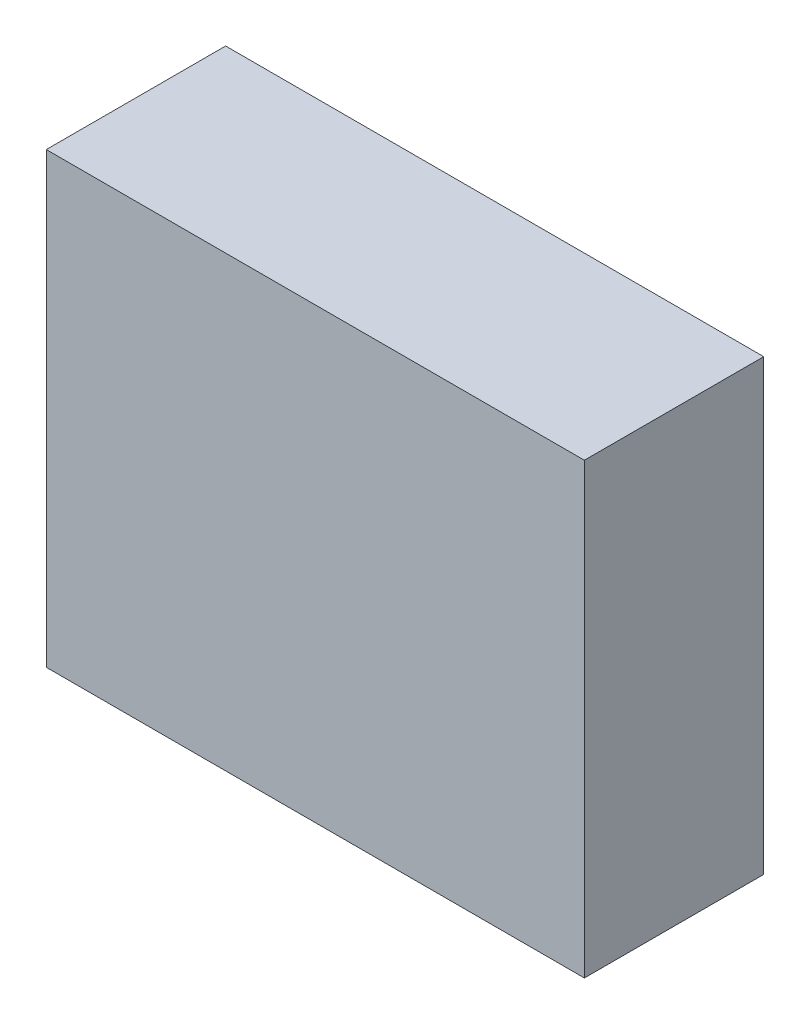
from build123d import *

# Parameters (mm, degrees)
SKETCH1_W           = 60
SKETCH1_H           = 50
BOSS_EXTRUDE1_DEPTH = 10
SKETCH2_W           = 15
SKETCH2_H           = 30
REVOLVE1_ANGLE      = 120


with BuildPart() as part:
    # Sketch1 → Boss-Extrude1 (new, symmetric)
    with BuildSketch(Plane.XY):
        with Locations((0, 15)):
            Rectangle(SKETCH1_W, SKETCH1_H)
    extrude(amount=BOSS_EXTRUDE1_DEPTH, both=True)

    # Sketch2 → Revolve1 (revolve)
    with BuildSketch(Plane.XY):
        with Locations((12.5, 15)):
            Rectangle(SKETCH2_W, SKETCH2_H)
    revolve(axis=Axis((0, 0, 0), (0, 1, 0)), revolution_arc=REVOLVE1_ANGLE)


solid = part.part
